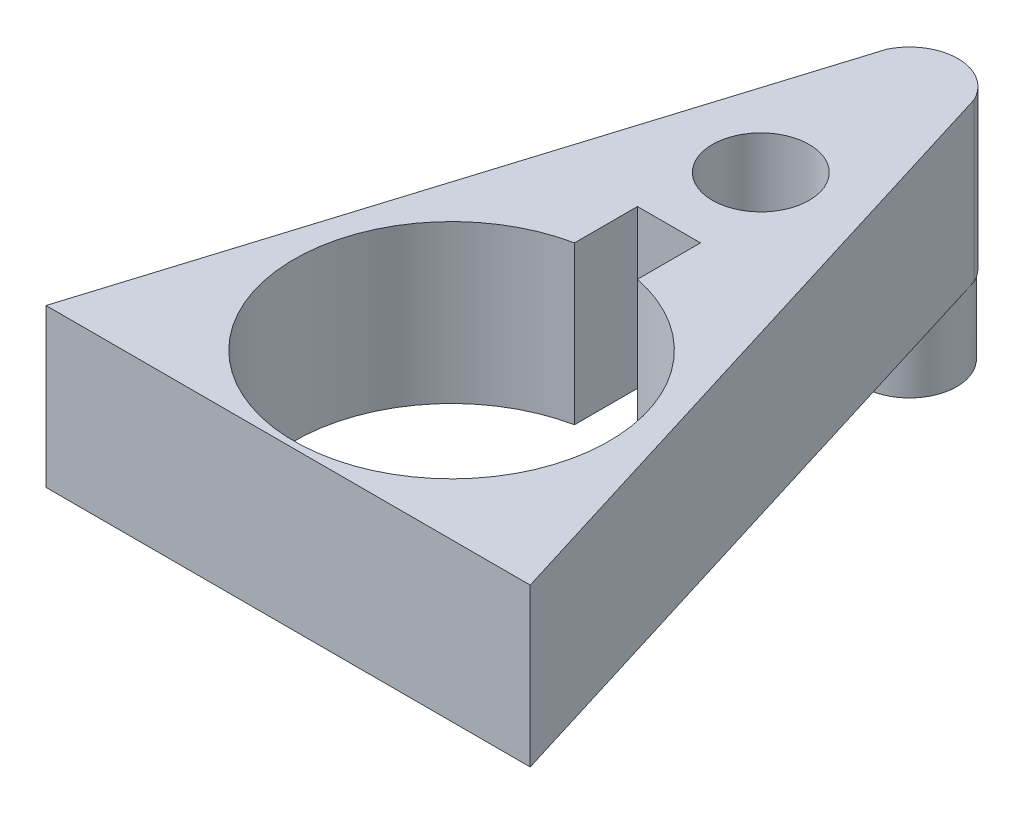
from build123d import *

# Parameters (mm, degrees)
SKETCH_1_R          = 3.073322802
EXTRUDE_1_DEPTH     = 10
SKETCH_2_R          = 3
EXTRUDE_2_DEPTH     = 5
CUT_EXTRUDE_1_DEPTH = 10


with BuildPart() as part:
    # 草图1 → 凸台-拉伸1 (new body)
    with BuildSketch(Plane(origin=(0, 0, 0), x_dir=(1, 0, 0), z_dir=(0, 1, 0))):
        with BuildLine():
            Line((0, 0), (30.73322802, 0))
            Line((30.73322802, 0), (18.141743603, 40.76055825))
            ThreePointArc((18.141743603, 40.76055825), (15.36661401, 42.513286949), (12.591484417, 40.76055825))
            Line((12.591484417, 40.76055825), (0, 0))
        make_face()
        with Locations(Location((15.36661401, 30, 0), (0, 0, 270))):
            Circle(SKETCH_1_R, mode=Mode.SUBTRACT)
    extrude(amount=EXTRUDE_1_DEPTH)

    # 草图2 → 凸台-拉伸2 (add)
    with BuildSketch(Plane.XZ):
        with Locations(Location((15.36661401, -39.439964147, 0), (0, 0, 90))):
            Circle(SKETCH_2_R)
    extrude(amount=EXTRUDE_2_DEPTH)

    # 草图3 → 切除-拉伸1 (cut)
    with BuildSketch(Plane(origin=(0, 10, 0), x_dir=(1, 0, 0), z_dir=(0, 1, 0))):
        with BuildLine():
            Line((13.327100422, 20.21204175), (13.327100422, 24.21204175))
            Line((13.327100422, 24.21204175), (17.327100422, 24.21204175))
            Line((17.327100422, 24.21204175), (17.327100422, 20.21204175))
            ThreePointArc((17.327100422, 20.21204175), (15.327100422, 0.414082779), (13.327100422, 20.21204175))
        make_face()
    extrude(amount=-CUT_EXTRUDE_1_DEPTH, mode=Mode.SUBTRACT)


solid = part.part
